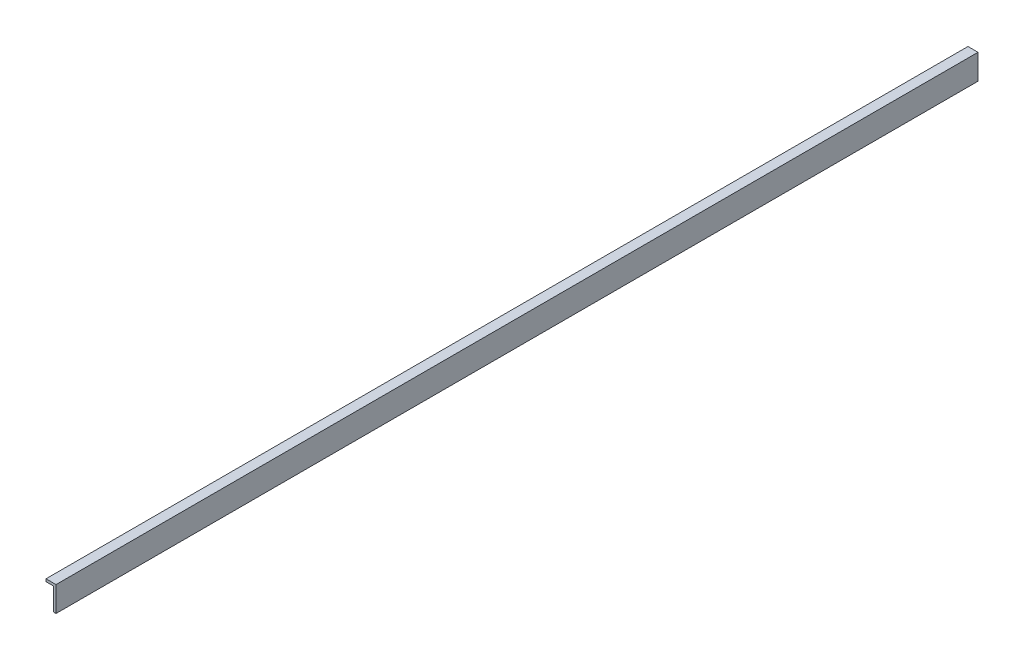
from build123d import *

# Parameters (mm, degrees)
STORE_KASET_L_RAF_1_SAG_1_START = -20
STORE_KASET_L_RAF_1_SAG_1_DEPTH = 735.5


with BuildPart() as part:
    # Sketch1 → STORE_kaset_L_raf_1_sag_1 (new body)
    with BuildSketch(Plane.XY.offset(STORE_KASET_L_RAF_1_SAG_1_START)):
        Polygon((205.5, 404.5), (207.5, 404.5), (207.5, 424.5), (199.5, 424.5), (199.5, 422.5), (205.5, 422.5), align=None)
    extrude(amount=-STORE_KASET_L_RAF_1_SAG_1_DEPTH)


solid = part.part
